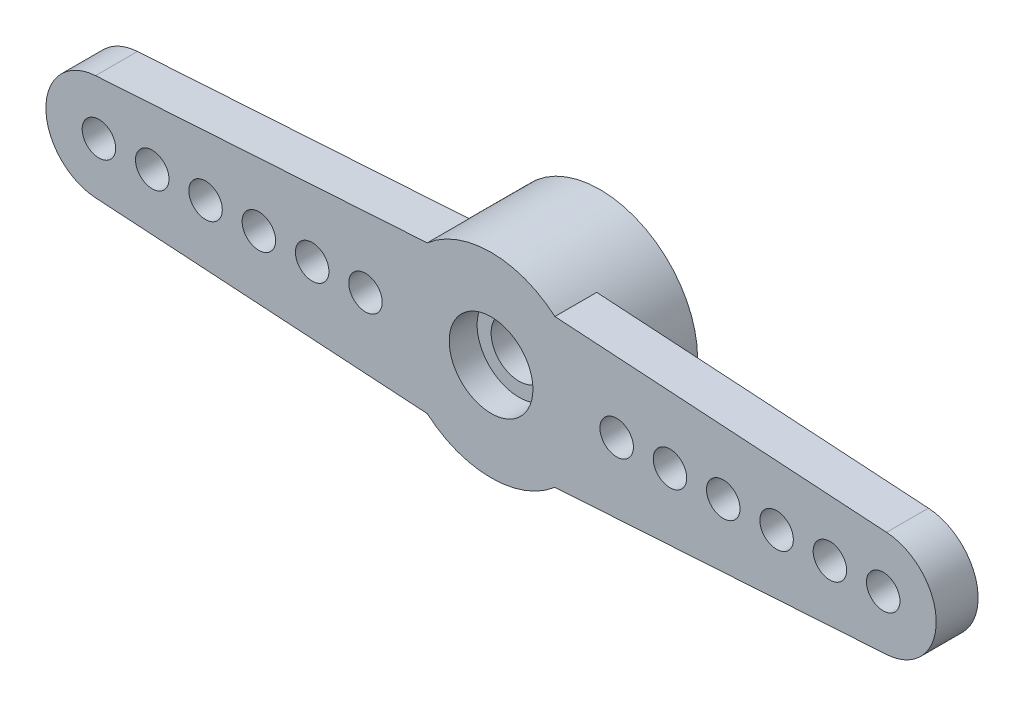
from build123d import *

# Parameters (mm, degrees)
SKETCH_1_R          = 3.5
EXTRUDE_1_DEPTH     = 3.9
EXTRUDE_START       = 2.4
SKETCH_1_6_R        = 0.6
EXTRUDE_2_DEPTH     = 1.5
SKETCH_1_3_R        = 2.5
CUT_EXTRUDE_1_DEPTH = 2
CUT_EXTRUDE_START   = 3.9
SKETCH_1_4_R        = 1.5
CUT_EXTRUDE_2_DEPTH = 1
SKETCH_1_5_R        = 1
CUT_EXTRUDE_3_DEPTH = 17.788761122


with BuildPart() as part:
    # 草图1 → 凸台-拉伸1 (new body)
    with BuildSketch(Plane.XY):
        Circle(SKETCH_1_R)
    extrude(amount=EXTRUDE_1_DEPTH)

    # 草图1<6> → 凸台-拉伸2 (add)
    with BuildSketch(Plane.XY.offset(EXTRUDE_START)):
        with BuildLine():
            Line((14.170277633, 1.89618915), (2.286372673, 2.65))
            ThreePointArc((2.286372673, 2.65), (3.5, 0), (2.286372673, -2.65))
            Line((2.286372673, -2.65), (14.170277633, -1.89618915))
            ThreePointArc((14.170277633, -1.89618915), (15.95, 0), (14.170277633, 1.89618915))
        make_face()
        with BuildLine():
            ThreePointArc((11.54, 0), (12.14, 0.6), (12.74, 0))
            ThreePointArc((12.74, 0), (12.14, -0.6), (11.54, 0))
        make_face(mode=Mode.SUBTRACT)
        with Locations((4.5, 0)):
            Circle(SKETCH_1_6_R, mode=Mode.SUBTRACT)
        with BuildLine():
            ThreePointArc((5.81, 0), (6.41, 0.6), (7.01, 0))
            ThreePointArc((7.01, 0), (6.41, -0.6), (5.81, 0))
        make_face(mode=Mode.SUBTRACT)
        with BuildLine():
            ThreePointArc((7.72, 0), (8.32, 0.6), (8.92, 0))
            ThreePointArc((8.92, 0), (8.32, -0.6), (7.72, 0))
        make_face(mode=Mode.SUBTRACT)
        with BuildLine():
            ThreePointArc((9.63, 0), (10.23, 0.6), (10.83, 0))
            ThreePointArc((10.83, 0), (10.23, -0.6), (9.63, 0))
        make_face(mode=Mode.SUBTRACT)
        with Locations((14.05, 0)):
            Circle(SKETCH_1_6_R, mode=Mode.SUBTRACT)
    extrude_2 = extrude(amount=EXTRUDE_2_DEPTH)

    # 镜向1: 凸台-拉伸2 across plane
    add(extrude_2.mirror(Plane(origin=(0, 0, 0), x_dir=(0, 0, 1), z_dir=(1, 0, 0))))

    # 草图1<3> → 切除-拉伸1 (cut)
    with BuildSketch(Plane.XY):
        Circle(SKETCH_1_3_R)
    extrude(amount=CUT_EXTRUDE_1_DEPTH, mode=Mode.SUBTRACT)

    # 草图1<4> → 切除-拉伸2 (cut)
    with BuildSketch(Plane.XY.offset(CUT_EXTRUDE_START)):
        Circle(SKETCH_1_4_R)
    extrude(amount=-CUT_EXTRUDE_2_DEPTH, mode=Mode.SUBTRACT)

    # 草图1<5> → 切除-拉伸3 (cut, through all)
    with BuildSketch(Plane.XY):
        Circle(SKETCH_1_5_R)
    extrude(amount=CUT_EXTRUDE_3_DEPTH, mode=Mode.SUBTRACT)


solid = part.part
